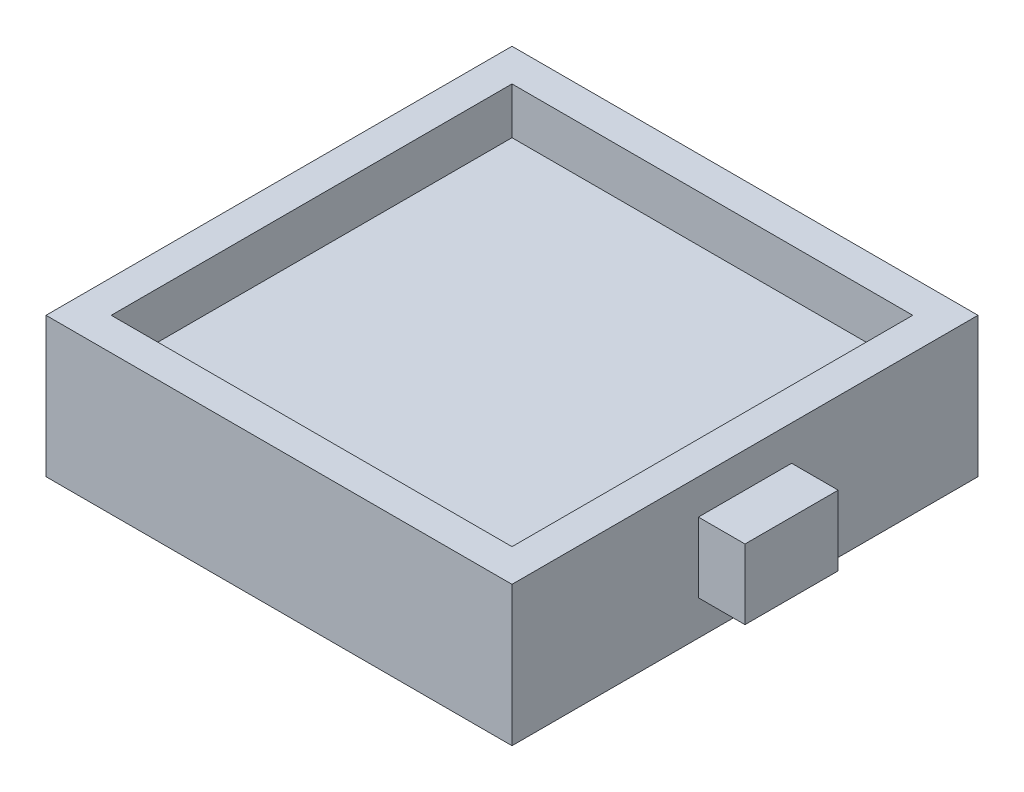
from build123d import *

# Parameters (mm, degrees)
SKETCH1_W           = 100
SKETCH1_H           = 100
BOSS_EXTRUDE1_DEPTH = 30
SKETCH2_W           = 86
SKETCH2_H           = 86
CUT_EXTRUDE1_DEPTH  = 10
SKETCH3_W           = 20
SKETCH3_H           = 15
BOSS_EXTRUDE2_DEPTH = 10


with BuildPart() as part:
    # Sketch1 → Boss-Extrude1 (new body)
    with BuildSketch(Plane(origin=(0, 0, 0), x_dir=(1, 0, 0), z_dir=(0, 1, 0))):
        Rectangle(SKETCH1_W, SKETCH1_H)
    extrude(amount=-BOSS_EXTRUDE1_DEPTH)

    # Sketch2 → Cut-Extrude1 (cut)
    with BuildSketch(Plane(origin=(0, 0, 0), x_dir=(1, 0, 0), z_dir=(0, 1, 0))):
        Rectangle(SKETCH2_W, SKETCH2_H)
    extrude(amount=-CUT_EXTRUDE1_DEPTH, mode=Mode.SUBTRACT)

    # Sketch3 → Boss-Extrude2 (add)
    with BuildSketch(Plane(origin=(50, 0, 0), x_dir=(0, 0, -1), z_dir=(1, 0, 0))):
        with Locations((0, -15)):
            Rectangle(SKETCH3_W, SKETCH3_H)
    extrude(amount=BOSS_EXTRUDE2_DEPTH)


solid = part.part
